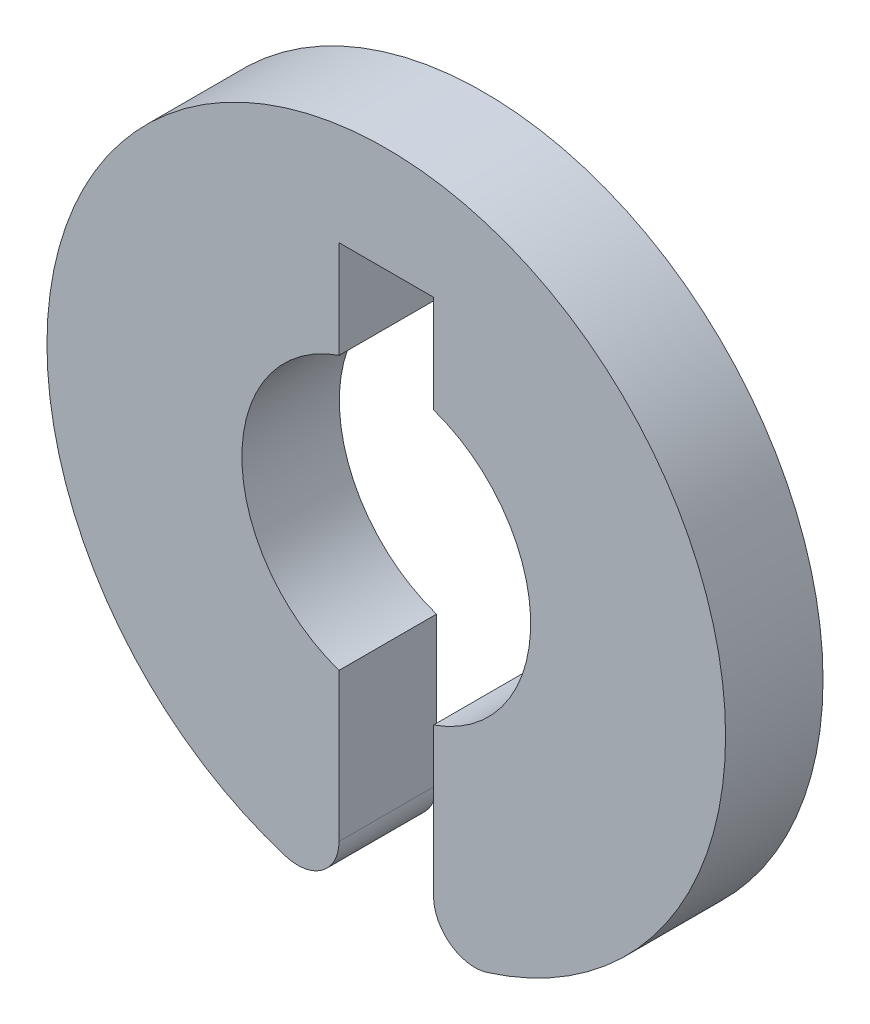
from build123d import *

# Parameters (mm, degrees)
EXTRUDE_1_DEPTH = 3
FILLET_1_R      = 1.27


with BuildPart() as part:
    # 스케치1 → 보스-돌출1 (new body)
    with BuildSketch(Plane.XY):
        with BuildLine():
            Line((-1.4475, 7.202709691), (1.4475, 7.202709691))
            Line((1.4475, 7.202709691), (1.4475, 4.202709691))
            ThreePointArc((1.4475, 4.202709691), (4.444998229, 0.003967412), (1.455, -4.200119046))
            Line((1.455, -4.200119046), (1.455, -10.343161992))
            ThreePointArc((1.455, -10.343161992), (0, 10.445), (-1.455, -10.343161992))
            Line((-1.455, -10.343161992), (-1.455, -4.200119046))
            ThreePointArc((-1.455, -4.200119046), (-4.444998229, 0.003967412), (-1.4475, 4.202709691))
            Line((-1.4475, 4.202709691), (-1.4475, 7.202709691))
        make_face()
    extrude(amount=EXTRUDE_1_DEPTH)

    # 필렛1
    fillet_1_edges = [part.edges().sort_by_distance(p)[0] for p in [
        (-1.455, -10.343161992, 1.5),
        (1.455, -10.343161992, 1.5),
    ]]
    fillet(fillet_1_edges, radius=FILLET_1_R)


solid = part.part
